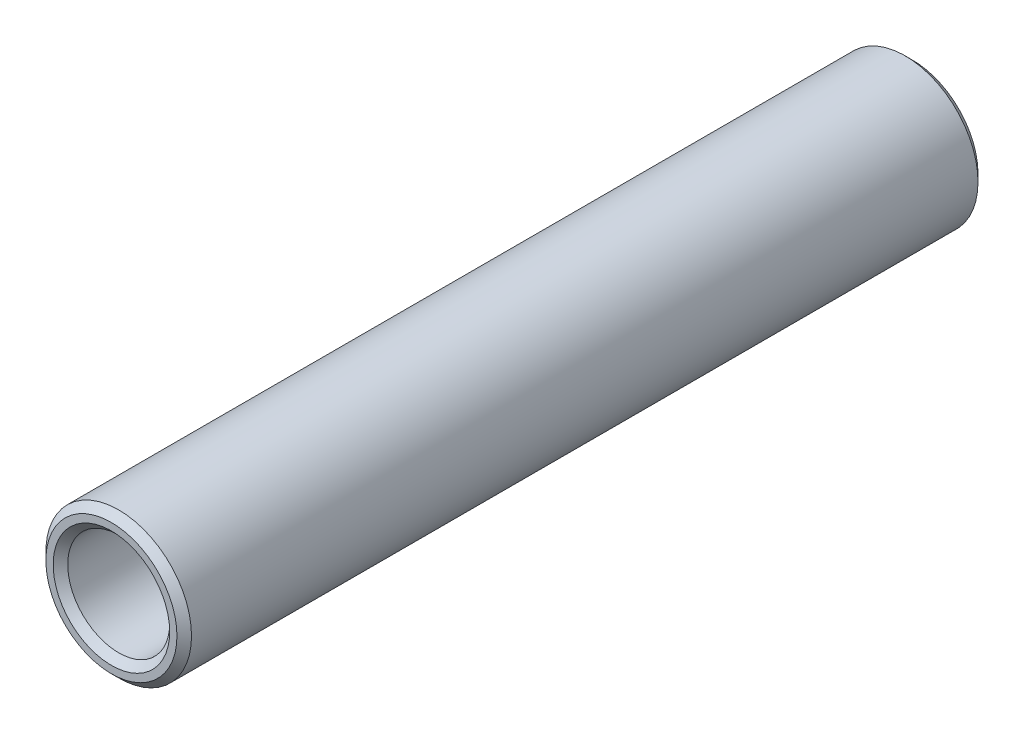
from build123d import *

# Parameters (mm, degrees)
SKIZZE1_R                       = 5
SKIZZE1_R_2                     = 3.5
AUFSATZ_LINEAR_AUSTRAGEN1_DEPTH = 55
FASE1_SIZE                      = 0.5


with BuildPart() as part:
    # Skizze1 → Aufsatz-Linear austragen1 (new body)
    with BuildSketch(Plane.XY):
        Circle(SKIZZE1_R)
        Circle(SKIZZE1_R_2, mode=Mode.SUBTRACT)
    extrude(amount=AUFSATZ_LINEAR_AUSTRAGEN1_DEPTH)

    # Fase1
    fase1_edges = [part.edges().sort_by_distance(p)[0] for p in [
        (-5, 0, 0),
        (-5, 0, 55),
        (-3.5, 0, 0),
        (-3.5, 0, 55),
    ]]
    chamfer(fase1_edges, length=FASE1_SIZE)


solid = part.part
